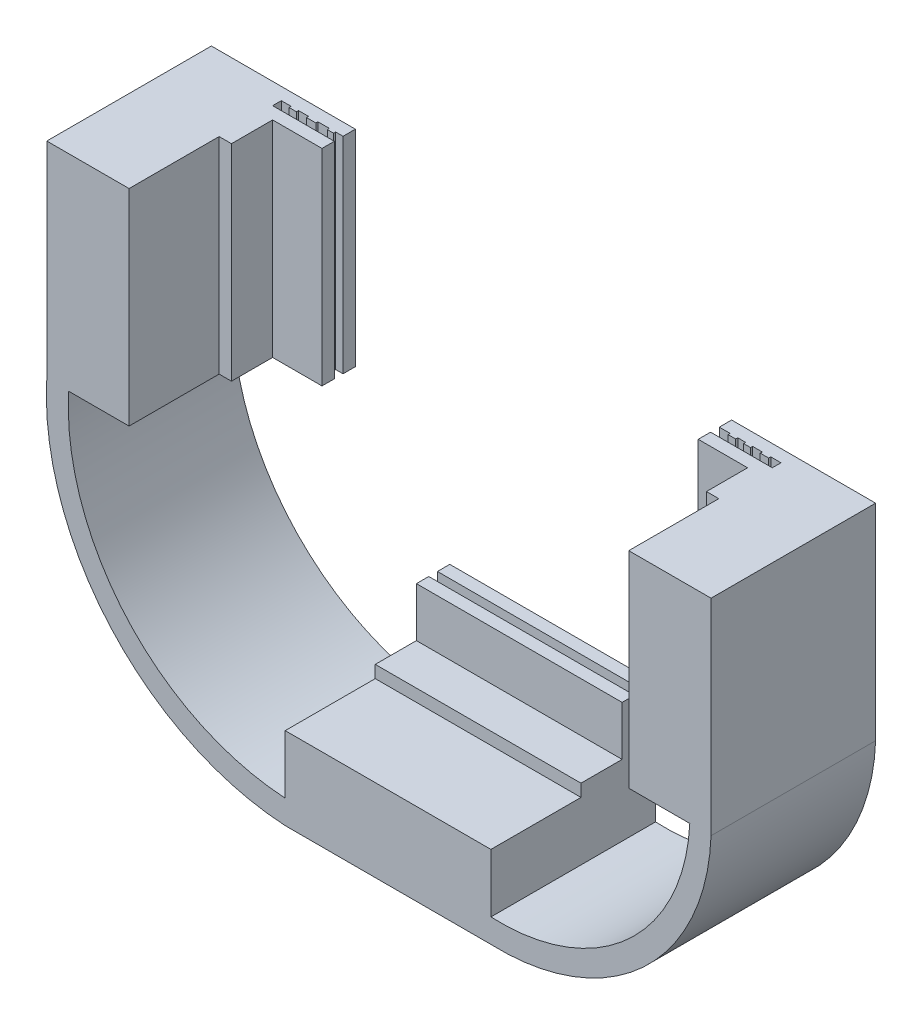
from build123d import *

# Parameters (mm, degrees)
SKETCH1_W             = 12.7
SKETCH1_H             = 5.08
BOSS_EXTRUDE1_DEPTH   = 10.16
SKETCH2_W             = 12.7
SKETCH2_H             = 0.762
BOSS_EXTRUDE3_DEPTH   = 3.81
BOSS_EXTRUDE4_DEPTH   = 3.81
BODY_MOVE_COPY3_ANGLE = 90
BODY_MOVE_COPY6_ANGLE = 180
BOSS_EXTRUDE6_DEPTH   = 10.16
SKETCH17_W            = 12.7
SKETCH17_H            = 0.586972929
SKETCH17_H_2          = 0.560182851
SKETCH17_H_3          = 0.470375136
SKETCH17_W_2          = 0.38891101
SKETCH17_H_4          = 12.7
SKETCH17_W_3          = 0.566388334
SKETCH17_W_4          = 0.460759313
SKETCH17_W_5          = 0.522714126
SKETCH17_W_6          = 0.418299814
SKETCH17_W_7          = 0.466316337
SKETCH17_H_5          = 12.693652269
BOSS_EXTRUDE10_DEPTH  = 0.127
SKETCH18_W            = 0.762
SKETCH18_H            = 12.7
SKETCH18_W_2          = 12.7
SKETCH18_H_2          = 0.762
BOSS_EXTRUDE11_DEPTH  = 2.54


with BuildPart() as part:
    # Sketch1 → Boss-Extrude1 (new body)
    with BuildSketch(Plane.XY):
        with Locations((6.35, 2.54)):
            Rectangle(SKETCH1_W, SKETCH1_H)
    extrude(amount=BOSS_EXTRUDE1_DEPTH)

    # Sketch2 → Boss-Extrude3 (add)
    with BuildSketch(Plane(origin=(0, 5.08, 0), x_dir=(1, 0, 0), z_dir=(0, 1, 0))):
        with Locations((6.35, -0.381)):
            Rectangle(SKETCH2_W, SKETCH2_H)
    extrude(amount=BOSS_EXTRUDE3_DEPTH)

    # Sketch4 → Boss-Extrude4 (add)
    with BuildSketch(Plane(origin=(0, 5.08, 0), x_dir=(1, 0, 0), z_dir=(0, 1, 0))):
        Polygon((1.196042578, -2.061016669), (0, -2.061016669), (0, -1.299016669), (1.196042578, -1.299016669), (12.7, -1.299016669), (12.7, -2.061016669), align=None)
    extrude(amount=BOSS_EXTRUDE4_DEPTH)


with BuildPart() as body_2:
    # Body-Move/Copy1: copy of part
    add(part.part.moved(Location((-19.746027861, 19.169390197, 0))))


with BuildPart() as body_2_1:
    # Body-Move/Copy3: moved
    add(body_2.part.rotate(Axis((-13.396027861, 25.765927537, 0), (0, 0, -1)), BODY_MOVE_COPY3_ANGLE))


with BuildPart() as body_3:
    # Body-Move/Copy5: copy of body 2
    add(body_2_1.part.moved(Location((40.507721278, -2.230163532, 0))))


with BuildPart() as body_3_1:
    # Body-Move/Copy6: moved
    add(body_3.part.rotate(Axis((27.111693417, 25.765927537, 0), (0, 0, 1)), BODY_MOVE_COPY6_ANGLE))


with BuildPart() as body_3_2:
    # Body-Move/Copy7: moved
    add(body_3_1.part.moved(Location((-7.419705442, -9.040319303, 0))))


with BuildPart() as body_2_2:
    # Body-Move/Copy8: moved
    add(body_2_1.part.moved(Location((5.274716885, -2.873342861, 0))))


with BuildPart() as part_1:
    add(part.part)

    add(body_2_2.part)  # Boss-Extrude6 merges body 2

    add(body_3_2.part)  # Boss-Extrude6 merges body 3
    # Sketch12 → Boss-Extrude6 (add)
    with BuildSketch(Plane.XY.offset(10.16)):
        with BuildLine():
            Line((-14.717848316, 16.542584676), (-13.364641255, 16.542584676))
            ThreePointArc((-13.364641255, 16.542584676), (-9.804171486, 6.237862161), (0, 1.46895531))
            Line((0, 1.46895531), (0, 0))
            ThreePointArc((0, 0), (-10.785005623, 5.223126147), (-14.717848316, 16.542584676))
        make_face()
        with BuildLine():
            Line((12.7, 1.46895531), (12.7, 0))
            ThreePointArc((12.7, 0), (22.105003473, 3.488610144), (26.288525315, 12.605771766))
            Line((26.288525315, 12.605771766), (24.975782085, 12.605771766))
            ThreePointArc((24.975782085, 12.605771766), (21.144401251, 4.494965824), (12.7, 1.46895531))
        make_face()
    extrude(amount=-BOSS_EXTRUDE6_DEPTH)

    # Sketch17 → Boss-Extrude10 (add)
    with BuildSketch(Plane.XY.offset(0.762)):
        with Locations((6.35, 8.007004569)):
            Rectangle(SKETCH17_W, SKETCH17_H)
        with Locations((6.35, 6.9171208)):
            Rectangle(SKETCH17_W, SKETCH17_H_2)
        with Locations((6.35, 5.881481875)):
            Rectangle(SKETCH17_W, SKETCH17_H_3)
        with Locations((-6.478997016, 22.892584676)):
            Rectangle(SKETCH17_W_2, SKETCH17_H_4)
        with Locations((-7.666574601, 22.892584676)):
            Rectangle(SKETCH17_W_3, SKETCH17_H_4)
        with Locations((-8.807561086, 22.892584676)):
            Rectangle(SKETCH17_W_4, SKETCH17_H_4)
        with Locations((20.31529367, 18.955771766)):
            Rectangle(SKETCH17_W_5, SKETCH17_H_4)
        with Locations((19.241203682, 18.955771766)):
            Rectangle(SKETCH17_W_6, SKETCH17_H_4)
        with Locations((18.30794503, 18.958945632)):
            Rectangle(SKETCH17_W_7, SKETCH17_H_5)
    extrude(amount=BOSS_EXTRUDE10_DEPTH)

    # Sketch18 → Boss-Extrude11 (add)
    with BuildSketch(Plane.XY.offset(2.061016669)):
        with Locations((-9.256848316, 22.892584676)):
            Rectangle(SKETCH18_W, SKETCH18_H)
        with Locations((6.35, 5.461)):
            Rectangle(SKETCH18_W_2, SKETCH18_H_2)
        with Locations((20.827525315, 18.955771766)):
            Rectangle(SKETCH18_W, SKETCH18_H)
    extrude(amount=BOSS_EXTRUDE11_DEPTH)


solid = part_1.part
